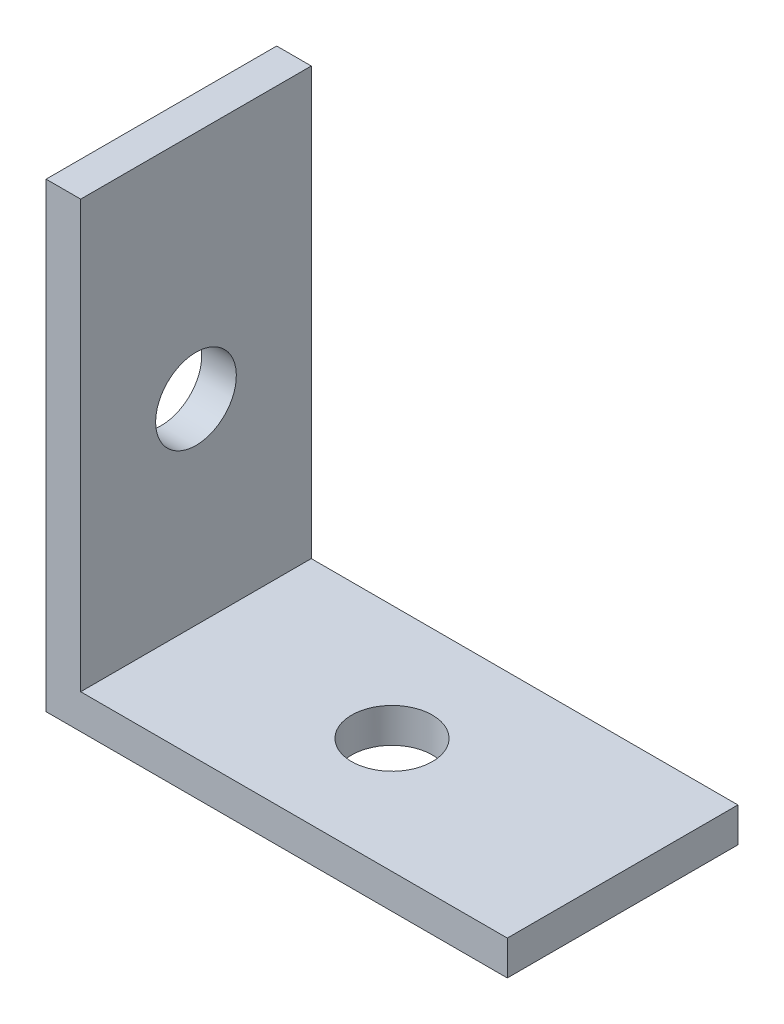
from build123d import *

# Parameters (mm, degrees)
EXTRUDE_1_DEPTH     = 10
CUT_EXTRUDE_1_REACH = 32
SKETCH_3_R          = 1.75


with BuildPart() as part:
    # Эскиз2 → Бобышка-Вытянуть1 (new body)
    with BuildSketch(Plane.XY):
        Polygon((0, 0), (0, 20), (1.5, 20), (1.5, 1.5), (20, 1.5), (20, 0), align=None)
    extrude(amount=EXTRUDE_1_DEPTH)

    # Эскиз3 → Вырез-Вытянуть1 (cut, up to next)
    with BuildSketch(Plane.XZ, mode=Mode.PRIVATE) as cut_extrude_1_sk1:
        with Locations((10, 5)):
            Circle(SKETCH_3_R)
    cut_extrude_1_tool1 = extrude(cut_extrude_1_sk1.sketch, amount=-CUT_EXTRUDE_1_REACH, mode=Mode.PRIVATE) & part.part
    cut_extrude_1 = cut_extrude_1_tool1.solids().sort_by_distance((10, 0, 5))[0]
    add(cut_extrude_1, mode=Mode.SUBTRACT)

    # Зеркальное отражение1: Вырез-Вытянуть1 across plane
    add(cut_extrude_1.mirror(Plane(origin=(0, 0, 0), x_dir=(0, 0, 1), z_dir=(-0.7071067811865471, 0.7071067811865479, 0))), mode=Mode.SUBTRACT)


solid = part.part
